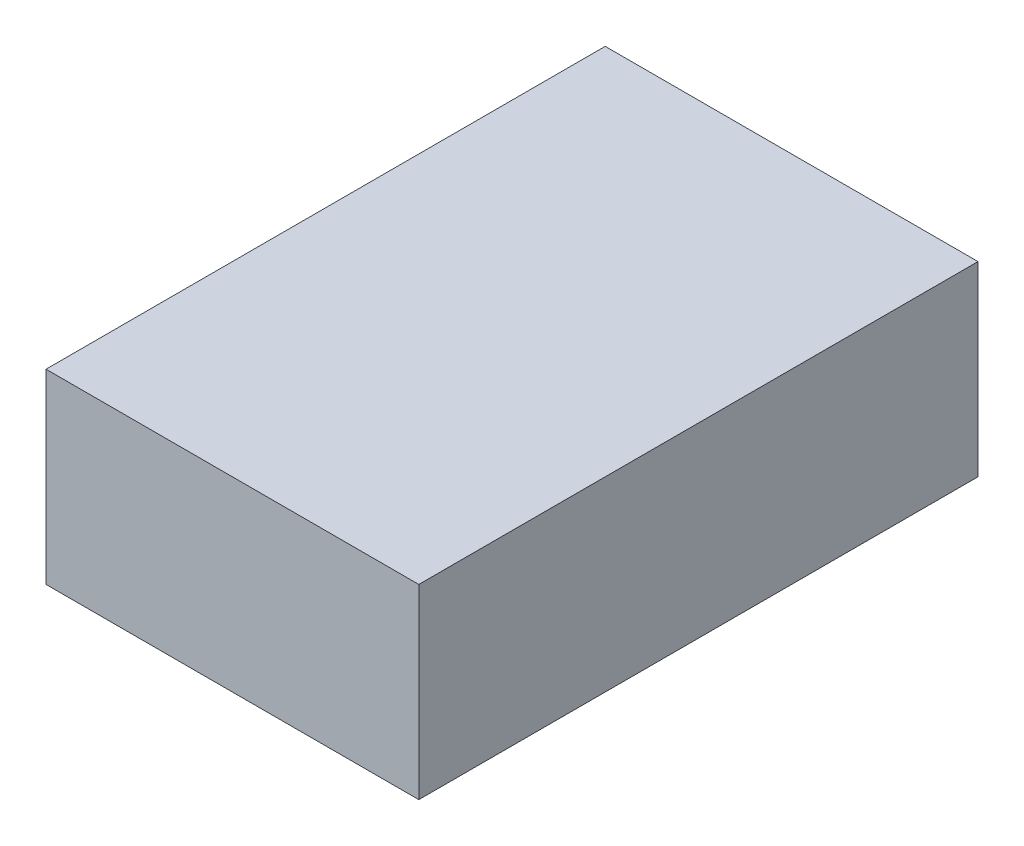
from build123d import *

# Parameters (mm, degrees)
SKETCH1_W           = 50.8
SKETCH1_H           = 76.2
BOSS_EXTRUDE1_DEPTH = 25.4


with BuildPart() as part:
    # Sketch1 → Boss-Extrude1 (new body)
    with BuildSketch(Plane(origin=(0, 0, 0), x_dir=(1, 0, 0), z_dir=(0, 1, 0))):
        Rectangle(SKETCH1_W, SKETCH1_H)
    extrude(amount=BOSS_EXTRUDE1_DEPTH)


solid = part.part
